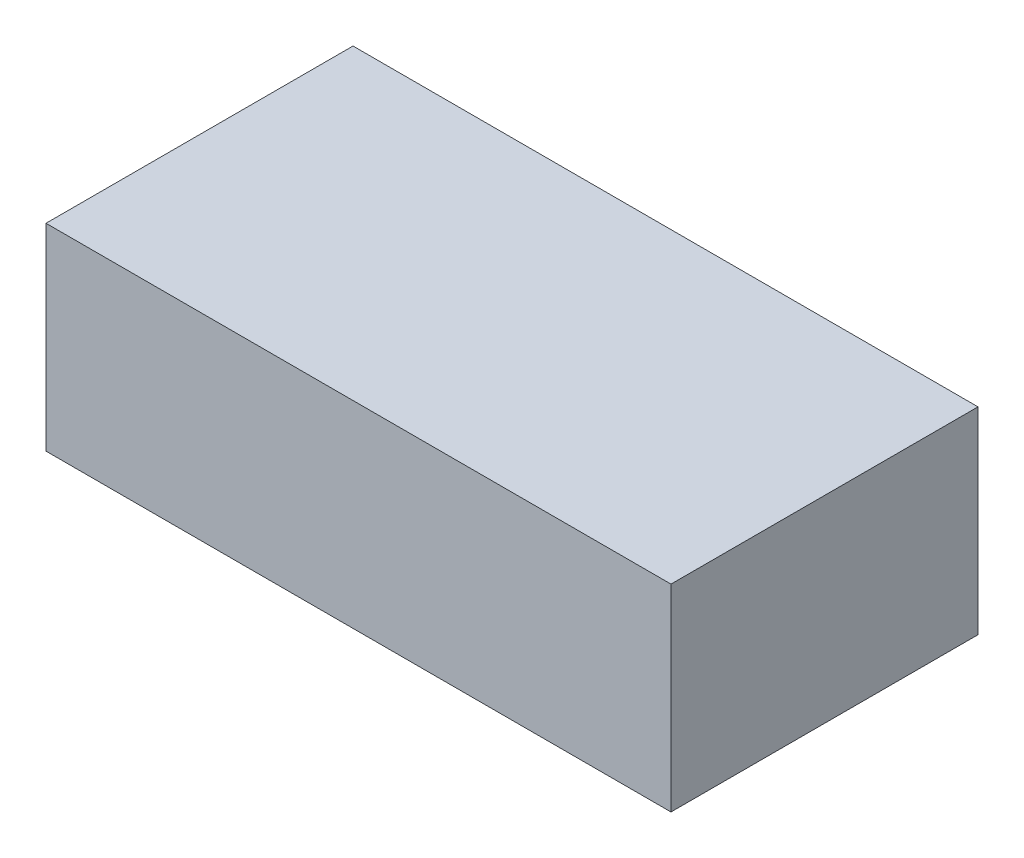
from build123d import *

# Parameters (mm, degrees)
SKETCH_1_W     = 57
SKETCH_1_H     = 18
SIDE_ARM_DEPTH = 28


with BuildPart() as part:
    # 草图1 → Side_arm (new body)
    with BuildSketch(Plane.XY):
        with Locations((28.5, 9)):
            Rectangle(SKETCH_1_W, SKETCH_1_H)
    extrude(amount=SIDE_ARM_DEPTH)


solid = part.part
